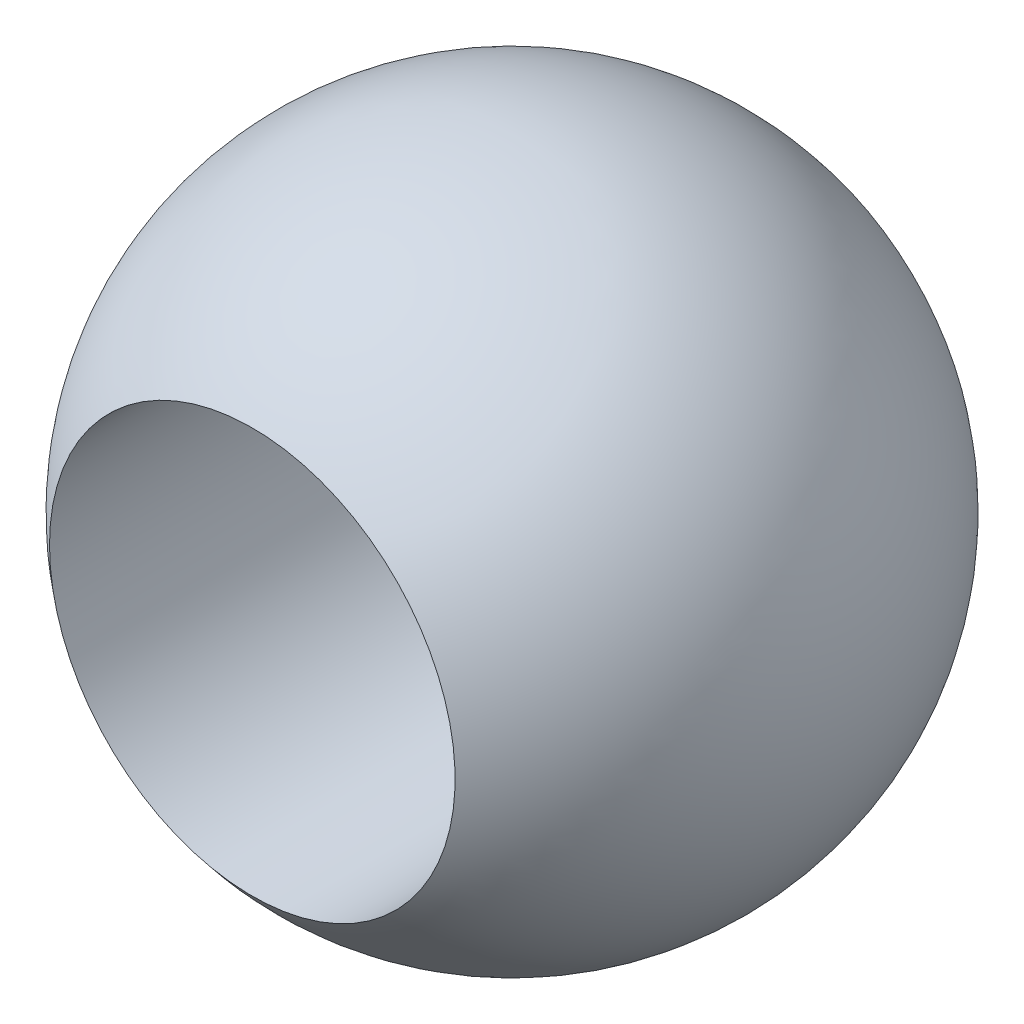
from build123d import *

# Parameters (mm, degrees)
SKETCH3_R          = 4
CUT_EXTRUDE1_DEPTH = 15


with BuildPart() as part:
    # Sketch1 → Revolve1 (revolve)
    with BuildSketch(Plane.XY):
        with BuildLine():
            Line((-6.5, 0), (6.5, 0))
            ThreePointArc((6.5, 0), (0, -6.5), (-6.5, 0))
        make_face()
    revolve(axis=Axis((-6.5, 0, 0), (1, 0, 0)))

    # Sketch3 → Cut-Extrude1 (cut, symmetric)
    with BuildSketch(Plane.XY):
        with Locations(Location((0, 0, 0), (0, 0, 180))):
            Circle(SKETCH3_R)
    extrude(amount=CUT_EXTRUDE1_DEPTH, both=True, mode=Mode.SUBTRACT)


solid = part.part
